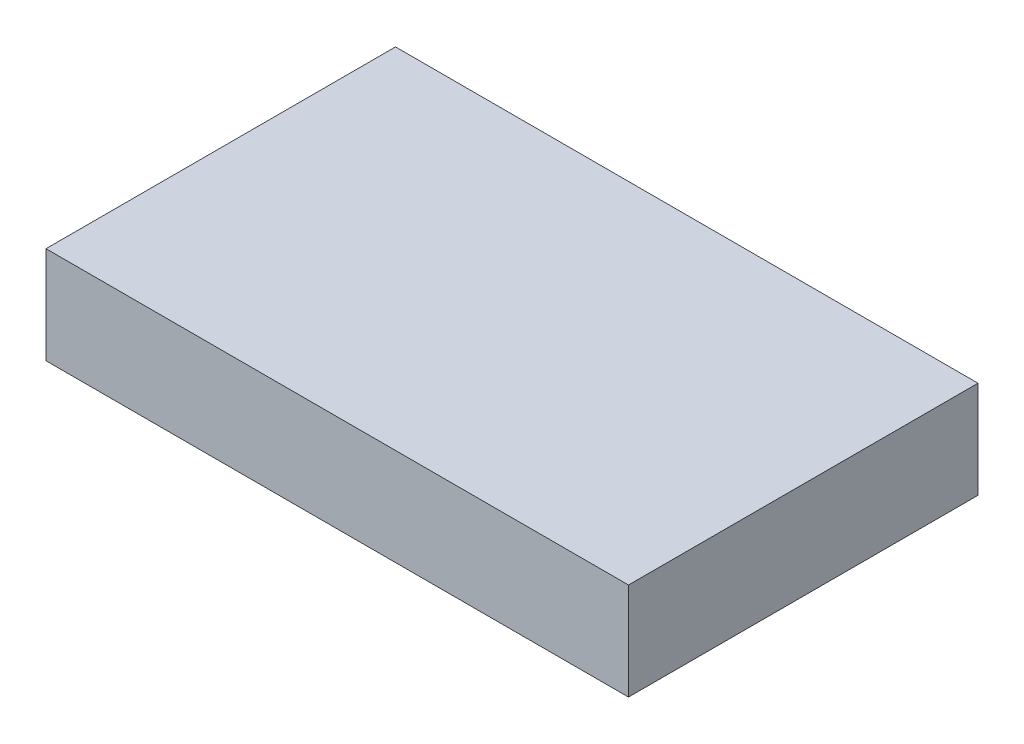
from build123d import *

# Parameters (mm, degrees)
SKETCH_1_W      = 30
SKETCH_1_H      = 18
EXTRUDE_1_DEPTH = 5


with BuildPart() as part:
    # 草图1 → 凸台-拉伸1 (new body)
    with BuildSketch(Plane(origin=(0, 0, 0), x_dir=(1, 0, 0), z_dir=(0, 1, 0))):
        with Locations((15, -9)):
            Rectangle(SKETCH_1_W, SKETCH_1_H)
    extrude(amount=EXTRUDE_1_DEPTH)


solid = part.part
